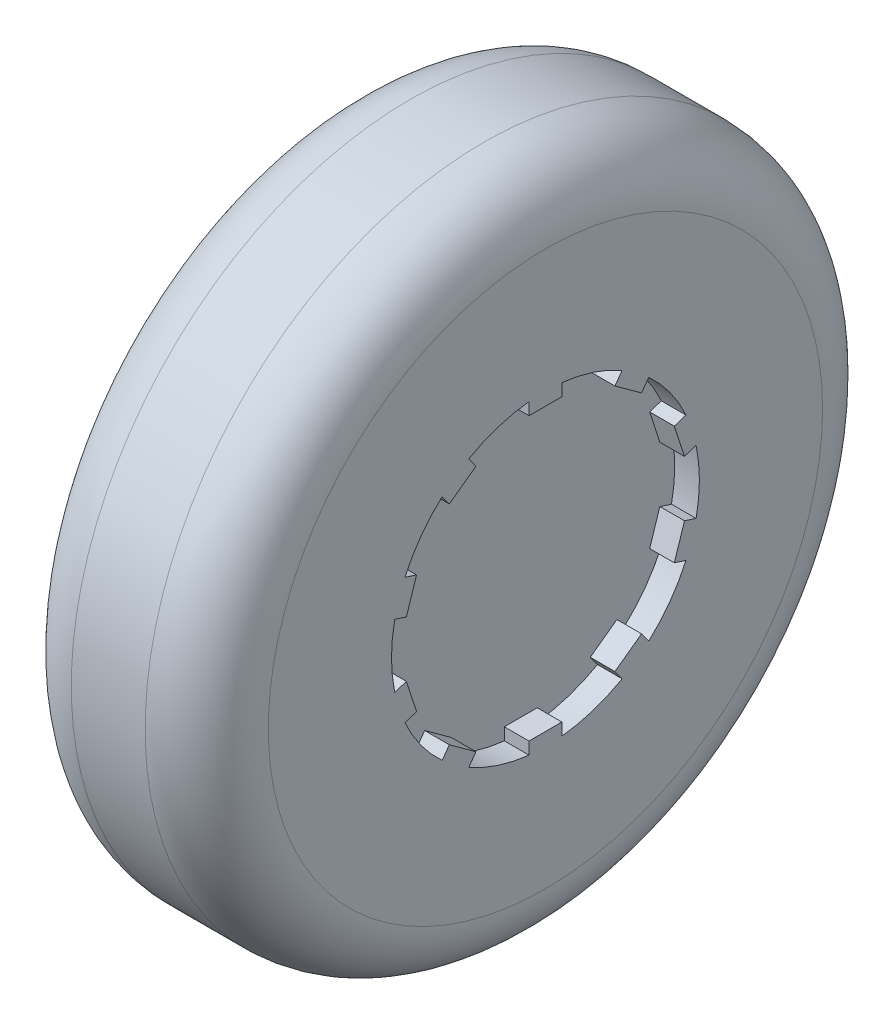
from build123d import *

# Parameters (mm, degrees)
SKETCH1_R           = 275
BOSS_EXTRUDE1_DEPTH = 160
FILLET1_R           = 50
SKETCH2_R           = 25
CUT_EXTRUDE1_DEPTH  = 50
SKETCH3_R           = 125
CUT_EXTRUDE2_DEPTH  = 20
SKETCH4_W           = 26.72203761
SKETCH4_H           = 21.282518002
BOSS_EXTRUDE2_DEPTH = 77


with BuildPart() as part:
    # Sketch1 → Boss-Extrude1 (new body)
    with BuildSketch(Plane(origin=(0, 0, 0), x_dir=(0, 0, -1), z_dir=(1, 0, 0))):
        Circle(SKETCH1_R)
    extrude(amount=BOSS_EXTRUDE1_DEPTH)

    # Fillet1
    fillet1_edges = [part.edges().sort_by_distance(p)[0] for p in [
        (0, 0, 275),
        (160, 0, 275),
    ]]
    fillet(fillet1_edges, radius=FILLET1_R)

    # Sketch2 → Cut-Extrude1 (cut)
    with BuildSketch(Plane.ZY):
        Circle(SKETCH2_R)
    extrude(amount=-CUT_EXTRUDE1_DEPTH, mode=Mode.SUBTRACT)

    # Sketch3 → Cut-Extrude2 (cut)
    with BuildSketch(Plane(origin=(160, 0, 0), x_dir=(0, 0, -1), z_dir=(1, 0, 0))):
        Circle(SKETCH3_R)
    extrude(amount=-CUT_EXTRUDE2_DEPTH, mode=Mode.SUBTRACT)

    # Sketch4 → Boss-Extrude2 (add)
    with BuildSketch(Plane(origin=(160, 0, 0), x_dir=(0, 0, -1), z_dir=(1, 0, 0))):
        with Locations((0, -125)):
            Rectangle(SKETCH4_W, SKETCH4_H)
        Polygon((-56.409090154, -100.371574733), (-68.918640367, -117.58949348), (-90.537222919, -101.882673861), (-78.027672706, -84.664755114), align=None)
        Polygon((-104.632843949, -48.045878423), (-124.873721378, -54.622538169), (-133.131285124, -29.208370171), (-112.890407695, -22.631710425), align=None)
        Polygon((-112.890407695, 22.631710425), (-133.131285124, 29.208370171), (-124.873721378, 54.622538169), (-104.632843949, 48.045878423), align=None)
        Polygon((-78.027672706, 84.664755114), (-90.537222919, 101.882673861), (-68.918640367, 117.58949348), (-56.409090154, 100.371574733), align=None)
        with Locations((0, 125)):
            Rectangle(SKETCH4_W, SKETCH4_H)
        Polygon((56.409090154, 100.371574733), (68.918640368, 117.58949348), (90.537222919, 101.882673861), (78.027672706, 84.664755114), align=None)
        Polygon((104.632843949, 48.045878423), (124.873721378, 54.622538169), (133.131285124, 29.208370171), (112.890407695, 22.631710425), align=None)
        Polygon((112.890407695, -22.631710425), (133.131285124, -29.208370171), (124.873721378, -54.622538169), (104.632843949, -48.045878423), align=None)
        Polygon((78.027672706, -84.664755114), (90.537222919, -101.882673861), (68.918640367, -117.58949348), (56.409090154, -100.371574733), align=None)
    extrude(amount=-BOSS_EXTRUDE2_DEPTH)


solid = part.part
